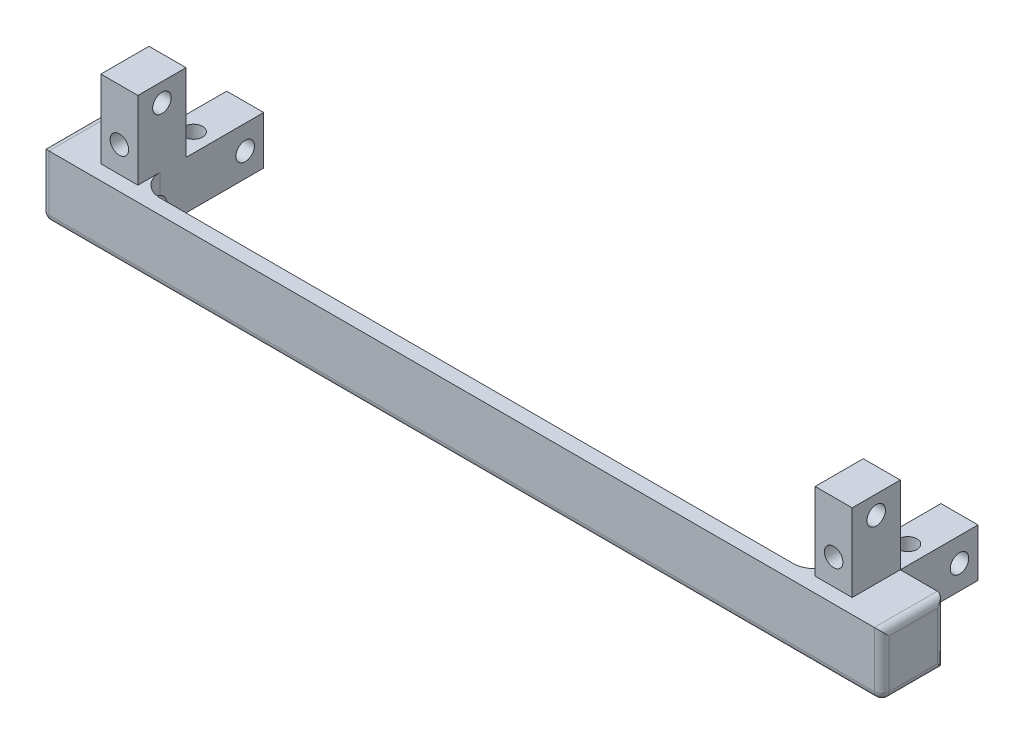
from build123d import *

# Parameters (mm, degrees)
SKETCH1_W                 = 113.5
SKETCH1_H                 = 8.5
BOSS_EXTRUDE1_DEPTH       = 8.5
BOSS_EXTRUDE2_DEPTH       = 5
BOSS_EXTRUDE3_DEPTH       = 5
SKETCH13_W                = 91.5
SKETCH13_H                = 6.5
CUT_EXTRUDE1_DEPTH        = 6.5
M3X0_5_TAPPED_HOLE1_D     = 2.5
M3X0_5_TAPPED_HOLE1_DEPTH = 7.5
M3X0_5_TAPPED_HOLE1_TIP   = 0.751075774
M3X0_5_TAPPED_HOLE2_D     = 2.5
M3X0_5_TAPPED_HOLE2_DEPTH = 5
M3X0_5_TAPPED_HOLE3_D     = 2.5
M3X0_5_TAPPED_HOLE3_DEPTH = 5
M3X0_5_TAPPED_HOLE4_D     = 2.5
M3X0_5_TAPPED_HOLE4_DEPTH = 7.5
M3X0_5_TAPPED_HOLE4_TIP   = 0.751075774
FILLET1_R                 = 1
FILLET2_R                 = 1
FILLET3_R                 = 1
FILLET4_R                 = 3
M3X0_5_TAPPED_HOLE5_D     = 2.5
M3X0_5_TAPPED_HOLE5_DEPTH = 7.5
M3X0_5_TAPPED_HOLE5_TIP   = 0.751075774
M3X0_5_TAPPED_HOLE6_D     = 2.5
M3X0_5_TAPPED_HOLE6_DEPTH = 7.5
M3X0_5_TAPPED_HOLE6_TIP   = 0.751075774
M3X0_5_TAPPED_HOLE7_D     = 2.5
M3X0_5_TAPPED_HOLE7_DEPTH = 7.5
M3X0_5_TAPPED_HOLE7_TIP   = 0.751075774
M3X0_5_TAPPED_HOLE9_D     = 2.5
M3X0_5_TAPPED_HOLE9_DEPTH = 7.5
M3X0_5_TAPPED_HOLE9_TIP   = 0.751075774
SKETCH43_W                = 10.5
SKETCH43_H                = 10.5
CUT_EXTRUDE3_DEPTH        = 110.01404726
F_8_36_TAPPED_HOLE1_D     = 3.4544
F_8_36_TAPPED_HOLE1_DEPTH = 12.1
F_8_36_TAPPED_HOLE1_TIP   = 1.037806461


with BuildPart() as part:
    # Sketch1 → Boss-Extrude1 (new body)
    with BuildSketch(Plane.XY):
        Rectangle(SKETCH1_W, SKETCH1_H)
    extrude(amount=BOSS_EXTRUDE1_DEPTH)

    # Sketch4 → Boss-Extrude2 (add)
    with BuildSketch(Plane(origin=(50.75, 0, 0), x_dir=(0, 0, -1), z_dir=(1, 0, 0))):
        Polygon((0, -2.25), (10.5, -2.25), (10.5, 14.75), (-6.5, 14.75), (-6.5, 4.25), (0, 4.25), align=None)
    extrude(amount=-BOSS_EXTRUDE2_DEPTH)

    # Sketch12 → Boss-Extrude3 (add)
    with BuildSketch(Plane.ZY.offset(50.75)):
        Polygon((6.5, 4.25), (6.5, 14.75), (-10.5, 14.75), (-10.5, -2.25), (0, -2.25), (0, 4.25), align=None)
    extrude(amount=-BOSS_EXTRUDE3_DEPTH)

    # Sketch13 → Cut-Extrude1 (cut)
    with BuildSketch(Plane(origin=(0, 4.25, 0), x_dir=(1, 0, 0), z_dir=(0, 1, 0))):
        with Locations((0, -3.25)):
            Rectangle(SKETCH13_W, SKETCH13_H)
    extrude(amount=-CUT_EXTRUDE1_DEPTH, mode=Mode.SUBTRACT)

    # M3x0.5 Tapped Hole1
    with Locations(Plane.XY.offset(6.5)):
        with Locations((-48.25, 7.75)):
            Hole(M3X0_5_TAPPED_HOLE1_D / 2, depth=M3X0_5_TAPPED_HOLE1_DEPTH)
            with Locations((0, 0, -(M3X0_5_TAPPED_HOLE1_DEPTH + M3X0_5_TAPPED_HOLE1_TIP / 2))):  # 118° drill point
                Cone(0, M3X0_5_TAPPED_HOLE1_D / 2, M3X0_5_TAPPED_HOLE1_TIP, mode=Mode.SUBTRACT)

    # M3x0.5 Tapped Hole2
    with Locations(Plane.ZY.offset(50.75)):
        with Locations((3.25, 12.25)):
            Hole(M3X0_5_TAPPED_HOLE2_D / 2, depth=M3X0_5_TAPPED_HOLE2_DEPTH)

    # M3x0.5 Tapped Hole3
    with Locations(Plane.ZY.offset(50.75)):
        with Locations((-8, 1)):
            Hole(M3X0_5_TAPPED_HOLE3_D / 2, depth=M3X0_5_TAPPED_HOLE3_DEPTH)

    # M3x0.5 Tapped Hole4
    with Locations(Plane.XZ.offset(2.25)):
        with Locations((-48.25, -3.5)):
            Hole(M3X0_5_TAPPED_HOLE4_D / 2, depth=M3X0_5_TAPPED_HOLE4_DEPTH)
            with Locations((0, 0, -(M3X0_5_TAPPED_HOLE4_DEPTH + M3X0_5_TAPPED_HOLE4_TIP / 2))):  # 118° drill point
                Cone(0, M3X0_5_TAPPED_HOLE4_D / 2, M3X0_5_TAPPED_HOLE4_TIP, mode=Mode.SUBTRACT)

    # Fillet1
    fillet1_edges = [part.edges().sort_by_distance(p)[0] for p in [
        (0, -4.25, 8.5),
    ]]
    fillet(fillet1_edges, radius=FILLET1_R)

    # Fillet2
    fillet2_edges = [part.edges().sort_by_distance(p)[0] for p in [
        (-56.75, 0.5, 8.5),
        (-56.75, 0, 0),
        (-56.75, 4.25, 4.25),
        (-56.75, -4.25, 3.75),
        (-56.75, -3.957106781, 8.207106781),
    ]]
    fillet(fillet2_edges, radius=FILLET2_R)

    # Fillet3
    fillet3_edges = [part.edges().sort_by_distance(p)[0] for p in [
        (56.75, 0, 0),
        (56.75, 4.25, 4.25),
        (56.75, 0.5, 8.5),
        (56.75, -4.25, 3.75),
        (56.75, -3.957106781, 8.207106781),
    ]]
    fillet(fillet3_edges, radius=FILLET3_R)

    # Fillet4
    fillet4_edges = [part.edges().sort_by_distance(p)[0] for p in [
        (-45.75, 1, 6.5),
        (45.75, 1, 6.5),
    ]]
    fillet(fillet4_edges, radius=FILLET4_R)

    # M3x0.5 Tapped Hole5
    with Locations(Plane.XY.offset(6.5)):
        with Locations((48.25, 7.75)):
            Hole(M3X0_5_TAPPED_HOLE5_D / 2, depth=M3X0_5_TAPPED_HOLE5_DEPTH)
            with Locations((0, 0, -(M3X0_5_TAPPED_HOLE5_DEPTH + M3X0_5_TAPPED_HOLE5_TIP / 2))):  # 118° drill point
                Cone(0, M3X0_5_TAPPED_HOLE5_D / 2, M3X0_5_TAPPED_HOLE5_TIP, mode=Mode.SUBTRACT)

    # M3x0.5 Tapped Hole6
    with Locations(Plane.XZ.offset(2.25)):
        with Locations((48.25, -3.5)):
            Hole(M3X0_5_TAPPED_HOLE6_D / 2, depth=M3X0_5_TAPPED_HOLE6_DEPTH)
            with Locations((0, 0, -(M3X0_5_TAPPED_HOLE6_DEPTH + M3X0_5_TAPPED_HOLE6_TIP / 2))):  # 118° drill point
                Cone(0, M3X0_5_TAPPED_HOLE6_D / 2, M3X0_5_TAPPED_HOLE6_TIP, mode=Mode.SUBTRACT)

    # M3x0.5 Tapped Hole7
    with Locations(Plane(origin=(50.75, 0, 0), x_dir=(0, 0, -1), z_dir=(1, 0, 0))):
        with Locations((8, 1)):
            Hole(M3X0_5_TAPPED_HOLE7_D / 2, depth=M3X0_5_TAPPED_HOLE7_DEPTH)
            with Locations((0, 0, -(M3X0_5_TAPPED_HOLE7_DEPTH + M3X0_5_TAPPED_HOLE7_TIP / 2))):  # 118° drill point
                Cone(0, M3X0_5_TAPPED_HOLE7_D / 2, M3X0_5_TAPPED_HOLE7_TIP, mode=Mode.SUBTRACT)

    # M3x0.5 Tapped Hole9
    with Locations(Plane(origin=(50.75, 0, 0), x_dir=(0, 0, -1), z_dir=(1, 0, 0))):
        with Locations((-3.25, 12.25)):
            Hole(M3X0_5_TAPPED_HOLE9_D / 2, depth=M3X0_5_TAPPED_HOLE9_DEPTH)
            with Locations((0, 0, -(M3X0_5_TAPPED_HOLE9_DEPTH + M3X0_5_TAPPED_HOLE9_TIP / 2))):  # 118° drill point
                Cone(0, M3X0_5_TAPPED_HOLE9_D / 2, M3X0_5_TAPPED_HOLE9_TIP, mode=Mode.SUBTRACT)

    # Sketch43 → Cut-Extrude3 (cut, through all)
    with BuildSketch(Plane.ZY.offset(50.75)):
        with Locations((-5.25, 9.5)):
            Rectangle(SKETCH43_W, SKETCH43_H)
    extrude(amount=-CUT_EXTRUDE3_DEPTH, mode=Mode.SUBTRACT)

    # #8-36 Tapped Hole1
    with Locations(Plane.ZY.offset(56.75)):
        with Locations((4.25, 0)):
            Hole(F_8_36_TAPPED_HOLE1_D / 2, depth=F_8_36_TAPPED_HOLE1_DEPTH)
            with Locations((0, 0, -(F_8_36_TAPPED_HOLE1_DEPTH + F_8_36_TAPPED_HOLE1_TIP / 2))):  # 118° drill point
                Cone(0, F_8_36_TAPPED_HOLE1_D / 2, F_8_36_TAPPED_HOLE1_TIP, mode=Mode.SUBTRACT)


solid = part.part
